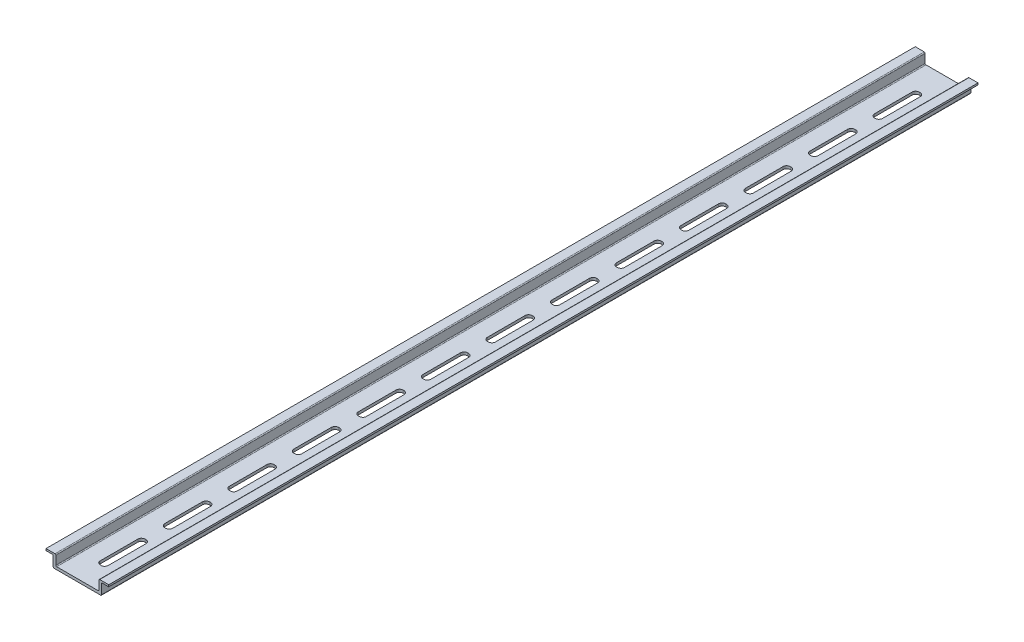
from build123d import *

# Parameters (mm, degrees)
BOSS_EXTRUDE1_DEPTH    = 242.5
FILLET1_R              = 0.5
SKETCH2_W              = 4.5
SKETCH2_H              = 25
CUT_EXTRUDE1_DEPTH     = 244.199794408
FILLET2_R              = 2
LPATTERN1_COUNT        = 13
LPATTERN1_PITCH        = 36
FILLET2_OF_LPATTERN1_R = 2


with BuildPart() as part:
    # Sketch1 → Boss-Extrude1 (new, symmetric)
    with BuildSketch(Plane.XY):
        Polygon((-13.5, 0), (13.5, 0), (13.5, 6.3), (17.5, 6.3), (17.5, 7.3), (12, 7.3), (12, 1.5), (-12, 1.5), (-12, 7.3), (-17.5, 7.3), (-17.5, 6.3), (-13.5, 6.3), align=None)
    extrude(amount=BOSS_EXTRUDE1_DEPTH, both=True)

    # Fillet1
    fillet1_edges = [part.edges().sort_by_distance(p)[0] for p in [
        (-13.5, 6.3, 0),
        (-12, 7.3, 0),
        (-12, 1.5, 0),
        (12, 1.5, 0),
        (12, 7.3, 0),
        (13.5, 6.3, 0),
        (13.5, 0, 0),
        (-13.5, 0, 0),
    ]]
    fillet(fillet1_edges, radius=FILLET1_R)

    # Sketch2 → Cut-Extrude1 (cut, through all)
    with BuildSketch(Plane(origin=(0, 1.5, 0), x_dir=(1, 0, 0), z_dir=(0, 1, 0))):
        with Locations((0, 215)):
            Rectangle(SKETCH2_W, SKETCH2_H)
    cut_extrude1 = extrude(amount=-CUT_EXTRUDE1_DEPTH, mode=Mode.SUBTRACT)

    # Fillet2
    fillet2_edges = [part.edges().sort_by_distance(p)[0] for p in [
        (2.25, 0.75, -227.5),
        (2.25, 0.75, -202.5),
        (-2.25, 0.75, -202.5),
        (-2.25, 0.75, -227.5),
    ]]
    fillet(fillet2_edges, radius=FILLET2_R)

    # LPattern1: Cut-Extrude1 ×13
    with Locations(*[(0, 0, i * LPATTERN1_PITCH) for i in range(1, LPATTERN1_COUNT)]):
        add(cut_extrude1, mode=Mode.SUBTRACT)

    # Fillet2 of LPattern1
    fillet2_of_lpattern1_edges = [part.edges().sort_by_distance(p)[0] for p in [
        (2.25, 0.75, -191.5),
        (2.25, 0.75, -166.5),
        (-2.25, 0.75, -166.5),
        (-2.25, 0.75, -191.5),
        (2.25, 0.75, -155.5),
        (2.25, 0.75, -130.5),
        (-2.25, 0.75, -130.5),
        (-2.25, 0.75, -155.5),
        (2.25, 0.75, -119.5),
        (2.25, 0.75, -94.5),
        (-2.25, 0.75, -94.5),
        (-2.25, 0.75, -119.5),
        (2.25, 0.75, -83.5),
        (2.25, 0.75, -58.5),
        (-2.25, 0.75, -58.5),
        (-2.25, 0.75, -83.5),
        (2.25, 0.75, -47.5),
        (2.25, 0.75, -22.5),
        (-2.25, 0.75, -22.5),
        (-2.25, 0.75, -47.5),
        (2.25, 0.75, -11.5),
        (2.25, 0.75, 13.5),
        (-2.25, 0.75, 13.5),
        (-2.25, 0.75, -11.5),
        (2.25, 0.75, 24.5),
        (2.25, 0.75, 49.5),
        (-2.25, 0.75, 49.5),
        (-2.25, 0.75, 24.5),
        (2.25, 0.75, 60.5),
        (2.25, 0.75, 85.5),
        (-2.25, 0.75, 85.5),
        (-2.25, 0.75, 60.5),
        (2.25, 0.75, 96.5),
        (2.25, 0.75, 121.5),
        (-2.25, 0.75, 121.5),
        (-2.25, 0.75, 96.5),
        (2.25, 0.75, 132.5),
        (2.25, 0.75, 157.5),
        (-2.25, 0.75, 157.5),
        (-2.25, 0.75, 132.5),
        (2.25, 0.75, 168.5),
        (2.25, 0.75, 193.5),
        (-2.25, 0.75, 193.5),
        (-2.25, 0.75, 168.5),
        (2.25, 0.75, 204.5),
        (2.25, 0.75, 229.5),
        (-2.25, 0.75, 229.5),
        (-2.25, 0.75, 204.5),
    ]]
    fillet(fillet2_of_lpattern1_edges, radius=FILLET2_OF_LPATTERN1_R)


solid = part.part
